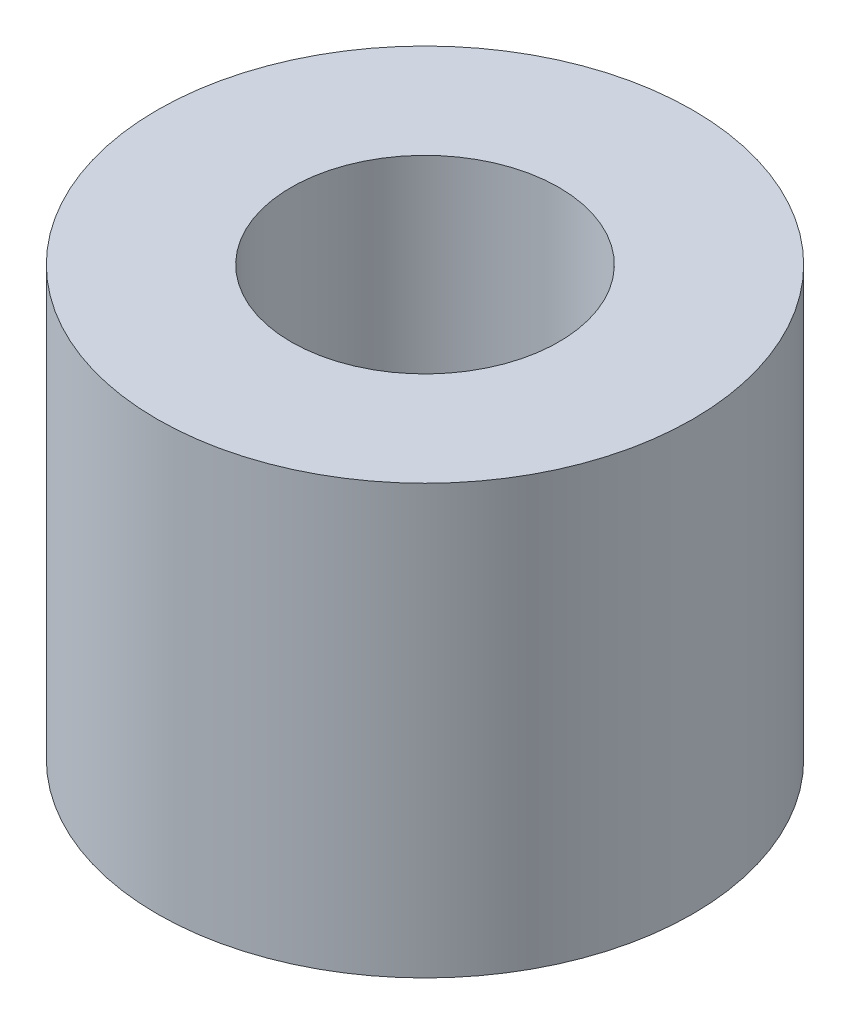
from build123d import *

# Parameters (mm, degrees)
SKETCH1_R           = 5
SKETCH1_R_2         = 2.5
BOSS_EXTRUDE1_DEPTH = 8


with BuildPart() as part:
    # Sketch1 → Boss-Extrude1 (new body)
    with BuildSketch(Plane(origin=(0, 0, 0), x_dir=(1, 0, 0), z_dir=(0, 1, 0))):
        with Locations(Location((0, 0, 0), (0, 0, 270))):
            Circle(SKETCH1_R)
        with Locations(Location((0, 0, 0), (0, 0, 270))):
            Circle(SKETCH1_R_2, mode=Mode.SUBTRACT)
    extrude(amount=BOSS_EXTRUDE1_DEPTH)


solid = part.part
